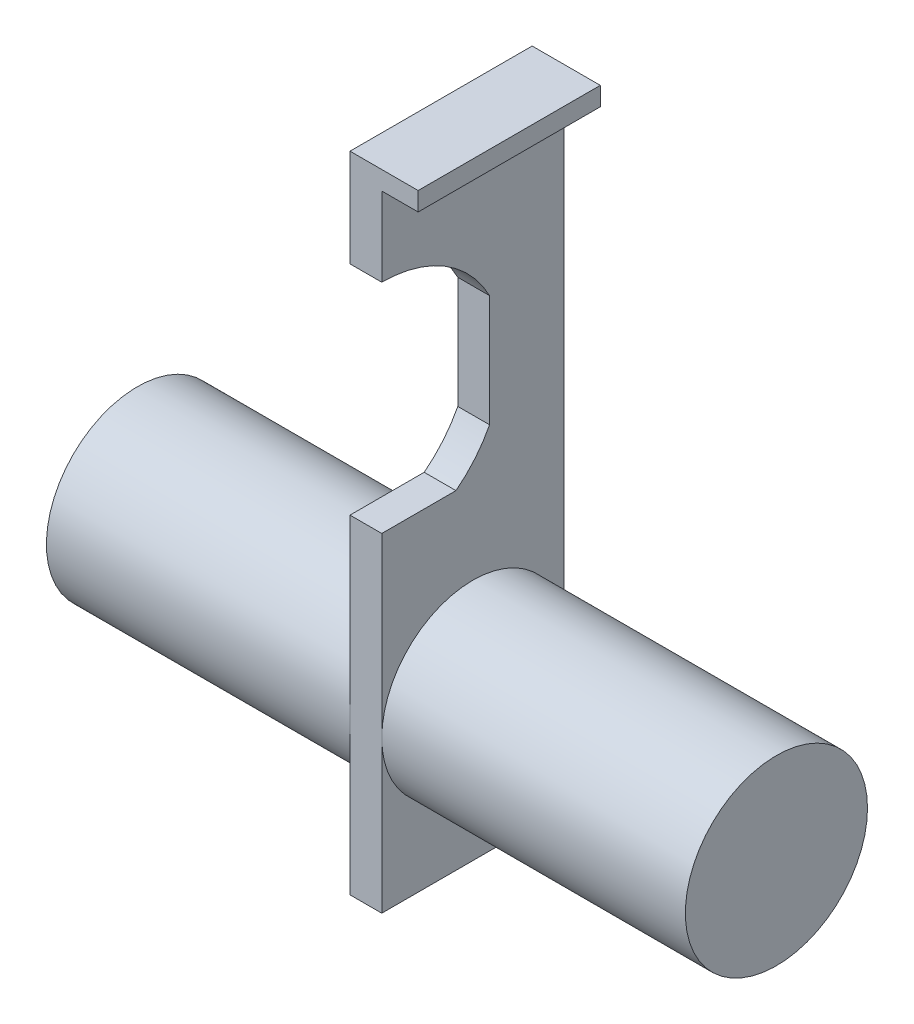
from build123d import *

# Parameters (mm, degrees)
BOSS_EXTRUDE1_DEPTH = 7.62
CUT_EXTRUDE2_DEPTH  = 6.35
SKETCH7_W           = 1.329001146
SKETCH7_H           = 7.62
BOSS_EXTRUDE2_DEPTH = 12.7
SKETCH8_R           = 3.81
BOSS_EXTRUDE3_DEPTH = 12.7
BOSS_EXTRUDE4_START = 12.7
SKETCH9_R           = 3.81
BOSS_EXTRUDE4_DEPTH = 12.7


with BuildPart() as part:
    # Sketch2 → Boss-Extrude1 (new body)
    with BuildSketch(Plane.XY):
        Polygon((1.329001146, -2.591505287), (1.329001146, 0.714117771), (2.850653855, 0.714117771), (2.850653855, 1.492637762), (1.329001146, 1.492637762), (0, 1.492637762), (0, 0.714117771), (0, -2.591505287), (0, -12.751505287), (1.329001146, -12.751505287), align=None)
    extrude(amount=BOSS_EXTRUDE1_DEPTH)

    # Sketch4 → Cut-Extrude2 (cut)
    with BuildSketch(Plane(origin=(1.329001146, 0, 0), x_dir=(0, 0, -1), z_dir=(1, 0, 0))):
        with BuildLine():
            Line((-3.110701149, -5.332141298), (-3.110701149, -10.010869275))
            ThreePointArc((-3.110701149, -10.010869275), (-3.721619208, -10.928655452), (-4.516161712, -11.693020907))
            Line((-4.516161712, -11.693020907), (-7.62, -11.693020907))
            Line((-7.62, -11.693020907), (-7.62, -2.591505287))
            ThreePointArc((-7.62, -2.591505287), (-4.981588457, -3.330401218), (-3.110701149, -5.332141298))
        make_face()
    extrude(amount=-CUT_EXTRUDE2_DEPTH, mode=Mode.SUBTRACT)

    # Sketch7 → Boss-Extrude2 (add)
    with BuildSketch(Plane.XZ.offset(12.751505287)):
        with Locations((0.664500573, 3.81)):
            Rectangle(SKETCH7_W, SKETCH7_H)
    extrude(amount=BOSS_EXTRUDE2_DEPTH)

    # Sketch8 → Boss-Extrude3 (add)
    with BuildSketch(Plane(origin=(1.329001146, 0, 0), x_dir=(0, 0, -1), z_dir=(1, 0, 0))):
        with Locations((-3.81, -19.101505287)):
            Circle(SKETCH8_R)
    extrude(amount=BOSS_EXTRUDE3_DEPTH)

    # Sketch9 → Boss-Extrude4 (add)
    with BuildSketch(Plane.ZY.offset(BOSS_EXTRUDE4_START)):
        with Locations(Location((3.81, -19.101505287, 0), (0, 0, 180))):
            Circle(SKETCH9_R)
    extrude(amount=-BOSS_EXTRUDE4_DEPTH)


solid = part.part
